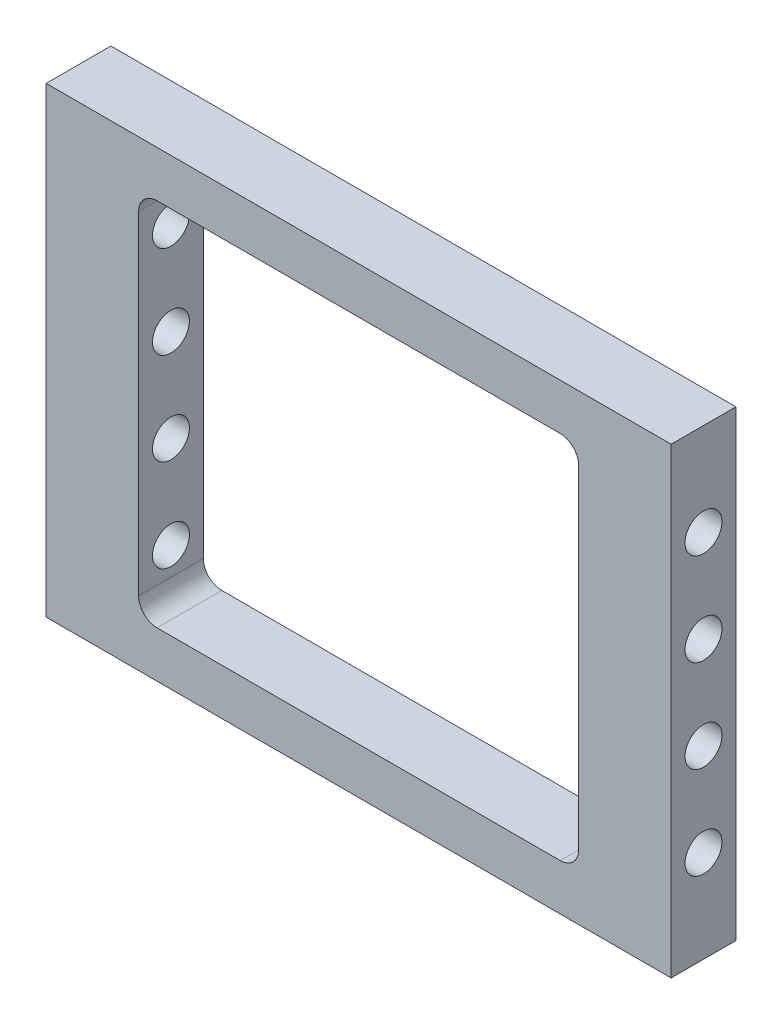
from build123d import *

# Parameters (mm, degrees)
SKETCH_1_W          = 67.6
SKETCH_1_H          = 50
EXTRUDE_1_DEPTH     = 7
SKETCH_2_R          = 2
CUT_EXTRUDE_1_DEPTH = 10
SKETCH_3_W          = 47.6
SKETCH_3_H          = 40
CUT_EXTRUDE_2_DEPTH = 7
FILLET_1_R          = 2


with BuildPart() as part:
    # 草图1 → 凸台-拉伸1 (new body)
    with BuildSketch(Plane.XY):
        with Locations((33.8, 25)):
            Rectangle(SKETCH_1_W, SKETCH_1_H)
    extrude(amount=EXTRUDE_1_DEPTH)

    # 草图2 → 切除-拉伸1 (cut)
    with BuildSketch(Plane.ZY):
        with Locations((3.5, 40)):
            Circle(SKETCH_2_R)
        with Locations((3.5, 30)):
            Circle(SKETCH_2_R)
        with Locations((3.5, 20)):
            Circle(SKETCH_2_R)
        with Locations((3.5, 10)):
            Circle(SKETCH_2_R)
    cut_extrude_1 = extrude(amount=-CUT_EXTRUDE_1_DEPTH, mode=Mode.SUBTRACT)

    # 镜向1: 切除-拉伸1 across plane
    add(cut_extrude_1.mirror(Plane(origin=(33.8, 0, 0), x_dir=(0, 0, 1), z_dir=(1, 0, 0))), mode=Mode.SUBTRACT)

    # 草图3 → 切除-拉伸2 (cut)
    with BuildSketch(Plane.XY.offset(7)):
        with Locations((33.8, 25)):
            Rectangle(SKETCH_3_W, SKETCH_3_H)
    extrude(amount=-CUT_EXTRUDE_2_DEPTH, mode=Mode.SUBTRACT)

    # 圆角1
    fillet_1_edges = [part.edges().sort_by_distance(p)[0] for p in [
        (10, 5, 3.5),
        (10, 45, 3.5),
        (57.6, 45, 3.5),
        (57.6, 5, 3.5),
    ]]
    fillet(fillet_1_edges, radius=FILLET_1_R)


solid = part.part
